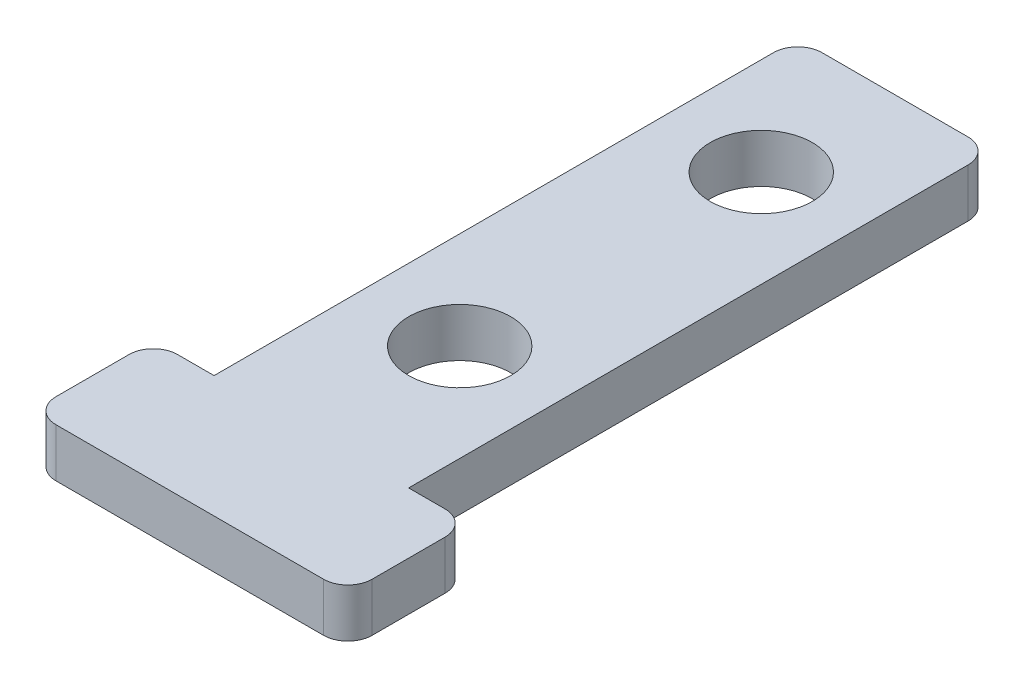
from build123d import *

# Parameters (mm, degrees)
SKETCH1_R           = 2.1
BOSS_EXTRUDE1_DEPTH = 2
FILLET1_R           = 1
FILLET2_R           = 1
FILLET3_R           = 1
FILLET4_R           = 1
FILLET5_R           = 1
FILLET6_R           = 1


with BuildPart() as part:
    # Sketch1 → Boss-Extrude1 (new body)
    with BuildSketch(Plane(origin=(0, 0, 0), x_dir=(1, 0, 0), z_dir=(0, 1, 0))):
        Polygon((-6.5, 0), (6.5, 0), (6.5, 5), (4, 5), (4, 29), (-4, 29), (-4, 5), (-6.5, 5), align=None)
        with Locations(Location((0, 11.1, 0), (0, 0, 270))):
            Circle(SKETCH1_R, mode=Mode.SUBTRACT)
        with Locations(Location((0, 23.5, 0), (0, 0, 270))):
            Circle(SKETCH1_R, mode=Mode.SUBTRACT)
    extrude(amount=BOSS_EXTRUDE1_DEPTH)

    # Fillet1
    fillet1_edges = [part.edges().sort_by_distance(p)[0] for p in [
        (6.5, 1, 0),
    ]]
    fillet(fillet1_edges, radius=FILLET1_R)

    # Fillet2
    fillet2_edges = [part.edges().sort_by_distance(p)[0] for p in [
        (6.5, 1, -5),
    ]]
    fillet(fillet2_edges, radius=FILLET2_R)

    # Fillet3
    fillet3_edges = [part.edges().sort_by_distance(p)[0] for p in [
        (-6.5, 1, 0),
    ]]
    fillet(fillet3_edges, radius=FILLET3_R)

    # Fillet4
    fillet4_edges = [part.edges().sort_by_distance(p)[0] for p in [
        (-6.5, 1, -5),
    ]]
    fillet(fillet4_edges, radius=FILLET4_R)

    # Fillet5
    fillet5_edges = [part.edges().sort_by_distance(p)[0] for p in [
        (-4, 1, -29),
    ]]
    fillet(fillet5_edges, radius=FILLET5_R)

    # Fillet6
    fillet6_edges = [part.edges().sort_by_distance(p)[0] for p in [
        (4, 1, -29),
    ]]
    fillet(fillet6_edges, radius=FILLET6_R)


solid = part.part
